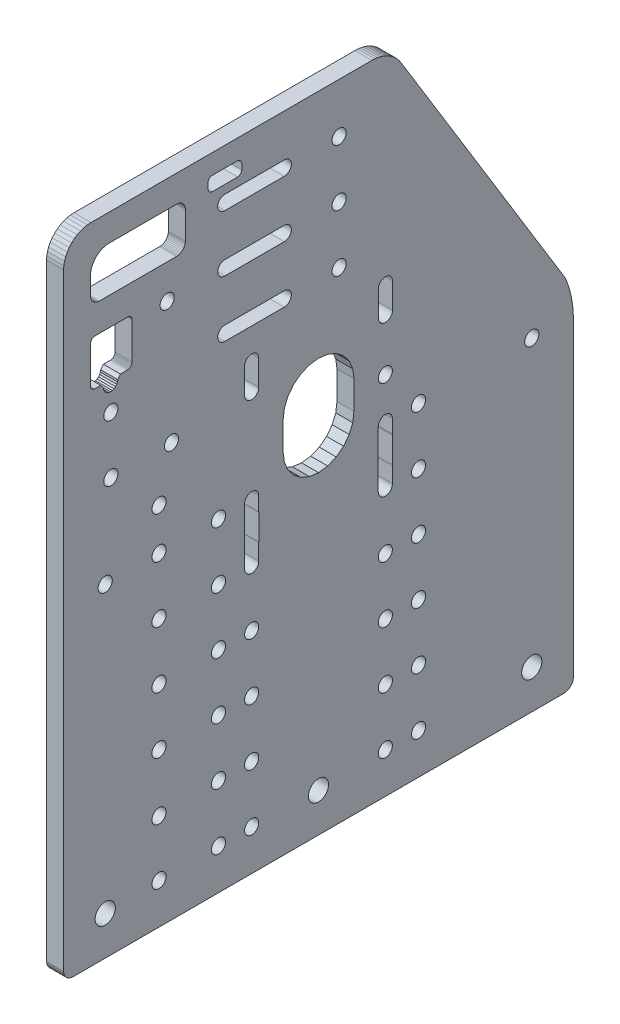
from build123d import *

# Parameters (mm, degrees)
SKETCH1_R           = 3.5685
SKETCH1_R_2         = 2.500000001
SKETCH1_R_3         = 2.5
BOSS_EXTRUDE1_DEPTH = 6
SKETCH2_R           = 2.500000001
SKETCH2_R_2         = 2.5
CUT_EXTRUDE3_DEPTH  = 1779.046328539


with BuildPart() as part:
    # Sketch1 → Boss-Extrude1 (new body)
    with BuildSketch(Plane(origin=(0, 0, 0), x_dir=(0, -1, 0), z_dir=(-1, 0, 0))):
        Polygon((-590.212112636, -1614.243728334), (-495.230350852, -1672.335619946), (-492.985489602, -1673.198794727), (-490.688058814, -1673.910331453), (-488.34828871, -1674.467061724), (-485.976598042, -1674.866506478), (-483.583547703, -1675.10688703), (-481.179793697, -1675.18713299), (-371.826596113, -1675.18713299), (-371.387664827, -1675.158363913), (-370.956243777, -1675.072548931), (-370.539714696, -1674.931156361), (-370.145204514, -1674.736605469), (-369.779463407, -1674.492225074), (-369.448749309, -1674.202196594), (-369.158720829, -1673.871482496), (-368.914340435, -1673.50574139), (-368.719789543, -1673.111231207), (-368.578396973, -1672.694702127), (-368.49258199, -1672.263281077), (-368.463812914, -1671.82434979), (-368.463812914, -1498.50991619), (-368.49258199, -1498.070984903), (-368.578396973, -1497.639563853), (-368.719789543, -1497.223034773), (-368.914340435, -1496.82852459), (-369.158720829, -1496.462783484), (-369.448749309, -1496.132069386), (-369.779463407, -1495.842040906), (-370.145204514, -1495.597660511), (-370.539714696, -1495.403109619), (-370.956243777, -1495.261717049), (-371.387664827, -1495.175902067), (-371.826596113, -1495.14713299), (-586.288106544, -1495.145619765), (-587.549717355, -1495.228301598), (-588.789742622, -1495.474950056), (-589.98696498, -1495.881344878), (-591.12089944, -1496.440532473), (-592.172143895, -1497.142944902), (-593.122711102, -1497.976563587), (-593.956336446, -1498.927124952), (-594.658756242, -1499.978364486), (-595.217951782, -1501.112295027), (-595.624354993, -1502.309514537), (-595.87101214, -1503.549538076), (-595.953702813, -1504.811148308), (-595.953702813, -1603.994310614), (-595.910202971, -1605.015955139), (-595.780018321, -1606.030204482), (-595.564091204, -1607.029716989), (-595.263984611, -1608.007257681), (-594.881870865, -1608.955750621), (-594.420515902, -1609.868330136), (-593.883259242, -1610.738390509), (-593.273989822, -1611.559633802), (-592.597117845, -1612.326115438), (-591.857542854, -1613.032287234), (-591.060618269, -1613.673037558), align=None)
        with Locations(Location((-382.159118976, -1509.84713299, 0), (0, 0, 90))):
            Circle(SKETCH1_R, mode=Mode.SUBTRACT)
        with Locations(Location((-382.159118976, -1585.16713299, 0), (0, 0, 90))):
            Circle(SKETCH1_R, mode=Mode.SUBTRACT)
        with Locations(Location((-382.159118976, -1660.48713299, 0), (0, 0, 90))):
            Circle(SKETCH1_R, mode=Mode.SUBTRACT)
        with Locations(Location((-538.399280751, -1592.457817223, 0), (0, 0, 90))):
            Circle(SKETCH1_R_2, mode=Mode.SUBTRACT)
        with Locations(Location((-558.44846865, -1592.457817223, 0), (0, 0, 90))):
            Circle(SKETCH1_R_2, mode=Mode.SUBTRACT)
        with Locations(Location((-578.44846865, -1592.457817223, 0), (0, 0, 90))):
            Circle(SKETCH1_R_2, mode=Mode.SUBTRACT)
        with Locations(Location((-534.443559506, -1511.847133017, 0), (0, 0, 90))):
            Circle(SKETCH1_R_2, mode=Mode.SUBTRACT)
        with Locations(Location((-558.402442437, -1531.722977175, 0), (0, 0, 90))):
            Circle(SKETCH1_R_2, mode=Mode.SUBTRACT)
        with Locations(Location((-514.443559639, -1511.847132679, 0), (0, 0, 90))):
            Circle(SKETCH1_R_2, mode=Mode.SUBTRACT)
        with Locations(Location((-514.443559639, -1533.238984755, 0), (0, 0, 90))):
            Circle(SKETCH1_R_2, mode=Mode.SUBTRACT)
        with Locations(Location((-497.496167838, -1528.847132988, 0), (0, 0, 90))):
            Circle(SKETCH1_R_3, mode=Mode.SUBTRACT)
        with Locations(Location((-482.799118976, -1549.84713299, 0), (0, 0, 90))):
            Circle(SKETCH1_R_2, mode=Mode.SUBTRACT)
        with Locations(Location((-482.799118976, -1509.84713299, 0), (0, 0, 90))):
            Circle(SKETCH1_R_2, mode=Mode.SUBTRACT)
        with Locations(Location((-482.799118976, -1620.48713299, 0), (0, 0, 90))):
            Circle(SKETCH1_R_2, mode=Mode.SUBTRACT)
        with Locations(Location((-482.799118977, -1660.487132991, 0), (0, 0, 90))):
            Circle(SKETCH1_R_2, mode=Mode.SUBTRACT)
        with Locations(Location((-402.49616799, -1528.847132989, 0), (0, 0, 90))):
            Circle(SKETCH1_R_2, mode=Mode.SUBTRACT)
        with BuildLine():
            Line((-575.977758464, -1552.084054241), (-575.977758464, -1573.056806032))
            ThreePointArc((-575.977758464, -1573.056806032), (-578.457148005, -1575.577342323), (-580.977684295, -1573.097952782))
            Line((-580.977684295, -1573.097952782), (-580.977684295, -1552.084054231))
            ThreePointArc((-580.977684295, -1552.084054231), (-578.477721375, -1549.570437307), (-575.977758464, -1552.084054241))
        make_face(mode=Mode.SUBTRACT)
        with BuildLine():
            Line((-535.977790671, -1552.085412401), (-535.977790671, -1573.058164192))
            ThreePointArc((-535.977790671, -1573.058164192), (-538.457180211, -1575.578700483), (-540.977716502, -1573.099310942))
            Line((-540.977716502, -1573.099310942), (-540.977716502, -1552.085412391))
            ThreePointArc((-540.977716502, -1552.085412391), (-538.477753581, -1549.571795467), (-535.977790671, -1552.085412401))
        make_face(mode=Mode.SUBTRACT)
        with BuildLine():
            Line((-555.97770846, -1552.099177314), (-555.97770846, -1573.085546029))
            ThreePointArc((-555.97770846, -1573.085546029), (-558.463906443, -1575.599273877), (-560.977634291, -1573.113075895))
            Line((-560.977634291, -1573.113075895), (-560.977634291, -1552.099177304))
            ThreePointArc((-560.977634291, -1552.099177304), (-558.47767137, -1549.58556036), (-555.97770846, -1552.099177314))
        make_face(mode=Mode.SUBTRACT)
        with BuildLine():
            Line((-524.913709892, -1559.055192962), (-515.913733671, -1559.055192962))
            ThreePointArc((-515.913733671, -1559.055192962), (-513.413733671, -1561.555192962), (-515.913733671, -1564.055192962))
            Line((-515.913733671, -1564.055192962), (-524.913709892, -1564.055192962))
            ThreePointArc((-524.913709892, -1564.055192962), (-527.413709892, -1561.555192962), (-524.913709892, -1559.055192962))
        make_face(mode=Mode.SUBTRACT)
        with BuildLine():
            Line((-524.913709892, -1606.299062763), (-515.913733671, -1606.299062763))
            ThreePointArc((-515.913733671, -1606.299062763), (-513.413733671, -1608.799062763), (-515.913733671, -1611.299062763))
            Line((-515.913733671, -1611.299062763), (-524.913709892, -1611.299062763))
            ThreePointArc((-524.913709892, -1611.299062763), (-527.413709892, -1608.799062763), (-524.913709892, -1606.299062763))
        make_face(mode=Mode.SUBTRACT)
        with BuildLine():
            Line((-477.66984009, -1606.299062763), (-468.669863869, -1606.299062763))
            ThreePointArc((-468.669863869, -1606.299062763), (-466.169863869, -1608.799062763), (-468.669863869, -1611.299062763))
            Line((-468.669863869, -1611.299062763), (-477.66984009, -1611.299062763))
            ThreePointArc((-477.66984009, -1611.299062763), (-480.16984009, -1608.799062763), (-477.66984009, -1606.299062763))
        make_face(mode=Mode.SUBTRACT)
        with BuildLine():
            Line((-477.669839463, -1559.052819647), (-468.669863869, -1559.055192962))
            ThreePointArc((-468.669863869, -1559.055192962), (-466.159015015, -1561.567366398), (-468.671188452, -1564.078215252))
            Line((-468.671188452, -1564.078215252), (-477.669845536, -1564.075842286))
            ThreePointArc((-477.669845536, -1564.075842286), (-480.18069465, -1561.564327931), (-477.669839463, -1559.052819647))
        make_face(mode=Mode.SUBTRACT)
        Polygon((-586.033555203, -1536.579108211), (-586.214987166, -1536.211200586), (-586.346845371, -1535.822758839), (-586.426873689, -1535.420429315), (-586.453702813, -1535.011095984), (-586.453702813, -1511.296236305), (-586.396818705, -1510.428352529), (-586.227139684, -1509.575318486), (-585.947569005, -1508.751729823), (-585.5628902, -1507.971678372), (-585.079685229, -1507.248511028), (-584.506221865, -1506.594601387), (-583.852312223, -1506.021138022), (-583.12914488, -1505.537933052), (-582.349093428, -1505.153254247), (-581.525504766, -1504.873683568), (-580.672470722, -1504.704004546), (-579.804586946, -1504.647120438), (-573.616888973, -1504.647120438), (-573.207555642, -1504.673949562), (-572.805226118, -1504.75397788), (-572.416784371, -1504.885836086), (-572.048876746, -1505.067268048), (-571.707798245, -1505.295169417), (-571.399384815, -1505.565640735), (-571.128913497, -1505.874054164), (-570.901012129, -1506.215132665), (-570.719580166, -1506.58304029), (-570.587721961, -1506.971482038), (-570.507693643, -1507.373811562), (-570.480864519, -1507.783144892), (-570.480864519, -1535.011095984), (-570.507693643, -1535.420429315), (-570.587721961, -1535.822758839), (-570.719580166, -1536.211200586), (-570.901012129, -1536.579108211), (-571.128913497, -1536.920186712), (-571.399384815, -1537.228600142), (-571.707798245, -1537.49907146), (-572.048876746, -1537.726972829), (-572.416784371, -1537.908404791), (-572.805226118, -1538.040262996), (-573.207555642, -1538.120291315), (-573.616888973, -1538.147120438), (-583.317678359, -1538.147120438), (-583.72701169, -1538.120291315), (-584.129341214, -1538.040262996), (-584.517782961, -1537.908404791), (-584.885690586, -1537.726972828), (-585.226769087, -1537.49907146), (-585.535182516, -1537.228600142), (-585.805653835, -1536.920186712), align=None, mode=Mode.SUBTRACT)
        Polygon((-560.539732338, -1505.878268758), (-560.469558584, -1505.671543545), (-560.373002121, -1505.475746407), (-560.251715057, -1505.294227488), (-560.107772647, -1505.130092628), (-559.943637786, -1504.986150218), (-559.762118868, -1504.864863154), (-559.56632173, -1504.768306692), (-559.359596516, -1504.698132938), (-559.131202133, -1504.647120439), (-558.927636825, -1504.641264366), (-548.4808636, -1504.645157132), (-545.881846575, -1504.645157132), (-545.667730411, -1504.687747485), (-545.461005198, -1504.757921239), (-545.26520806, -1504.854477702), (-545.083689141, -1504.975764766), (-544.919554281, -1505.119707176), (-544.775611871, -1505.283842037), (-544.654324807, -1505.465360956), (-544.557768345, -1505.661158094), (-544.487594591, -1505.867883307), (-544.445004238, -1506.081999471), (-544.441434684, -1508.267709423), (-543.221041992, -1509.237688263), (-542.573960137, -1509.322613597), (-541.970907354, -1509.572122279), (-541.452980696, -1509.969210703), (-541.055476008, -1510.486817951), (-540.805482577, -1511.089669943), (-540.720037042, -1511.736683313), (-540.804962376, -1512.383765169), (-541.054471058, -1512.986817951), (-541.451559482, -1513.504744609), (-541.96916673, -1513.902249297), (-542.572018722, -1514.152242729), (-543.219032092, -1514.237688263), (-544.432285676, -1515.207667102), (-544.430726027, -1517.677645941), (-544.487594599, -1518.109605632), (-544.557768353, -1518.316330846), (-544.654324816, -1518.512127983), (-544.77561188, -1518.693646902), (-544.91955429, -1518.857781763), (-545.083689151, -1519.001724172), (-545.26520807, -1519.123011236), (-545.461005208, -1519.219567699), (-545.667730421, -1519.289741453), (-546.099691027, -1519.348570172), (-558.957839921, -1519.342717258), (-559.145480362, -1519.342717258), (-559.359596526, -1519.300126905), (-559.566321739, -1519.229953151), (-559.762118877, -1519.133396688), (-559.943637796, -1519.012109624), (-560.107772656, -1518.868167214), (-560.251715066, -1518.704032353), (-560.37300213, -1518.522513435), (-560.469558592, -1518.326716297), (-560.539732347, -1518.119991083), (-560.582322699, -1517.905874919), (-560.582322699, -1517.679609247), (-560.568044472, -1506.083962777), align=None, mode=Mode.SUBTRACT)
        Polygon((-512.609294248, -1578.937135138), (-510.622811466, -1576.348300373), (-508.033976701, -1574.36181759), (-505.019214764, -1573.113062308), (-501.7839767, -1572.687135137), (-491.783976402, -1572.687135137), (-488.548738338, -1573.113062308), (-485.533976401, -1574.36181759), (-482.945141636, -1576.348300373), (-480.958658854, -1578.937135138), (-479.709903572, -1581.951897074), (-479.283976401, -1585.187135138), (-479.709903572, -1588.422373202), (-480.958658854, -1591.437135139), (-482.945141636, -1594.025969904), (-485.533976401, -1596.012452687), (-488.548738338, -1597.261207968), (-491.783976402, -1597.68713514), (-501.7839767, -1597.68713514), (-505.019214764, -1597.261207968), (-508.033976701, -1596.012452687), (-510.622811466, -1594.025969904), (-512.609294248, -1591.437135139), (-513.85804953, -1588.422373202), (-514.283976701, -1585.187135138), (-513.85804953, -1581.951897074), align=None, mode=Mode.SUBTRACT)
        with BuildLine():
            Line((-588.98086362, -1556.648178727), (-588.98086362, -1547.550419842))
            ThreePointArc((-588.98086362, -1547.550419842), (-588.50376059, -1546.590680791), (-587.544021697, -1546.113577446))
            Line((-587.544021697, -1546.113577446), (-585.643575513, -1546.099299227))
            ThreePointArc((-585.643575513, -1546.099299227), (-584.463439705, -1546.588127429), (-583.974611428, -1547.768263206))
            Line((-583.974611428, -1547.768263206), (-583.988889647, -1556.648178564))
            ThreePointArc((-583.988889647, -1556.648178564), (-584.465992569, -1557.607917612), (-585.425731394, -1558.085020984))
            Line((-585.425731394, -1558.085020984), (-587.544021696, -1558.085020984))
            ThreePointArc((-587.544021696, -1558.085020984), (-588.506313615, -1557.610470755), (-588.98086362, -1556.648178727))
        make_face(mode=Mode.SUBTRACT)
    extrude(amount=-BOSS_EXTRUDE1_DEPTH)

    # Sketch2 → Cut-Extrude3 (cut, through all)
    with BuildSketch(Plane(origin=(6, 0, 0), x_dir=(0, 0, -1), z_dir=(1, 0, 0))):
        with BuildLine():
            Line((1606.267132989, 482.799118976), (1606.267132989, 462.799118976))
            ThreePointArc((1606.267132989, 462.799118976), (1608.76713299, 460.299118975), (1611.267132991, 462.799118976))
            Line((1611.267132991, 462.799118976), (1611.267132991, 482.799118976))
            ThreePointArc((1611.267132991, 482.799118976), (1608.76713299, 485.299118977), (1606.267132989, 482.799118976))
        make_face()
        with Locations((1549.84713299, 442.799118976)):
            Circle(SKETCH2_R)
        with Locations(Location((1549.84713299, 482.799118976, 0), (0, 0, 180))):
            Circle(SKETCH2_R)
        with Locations((1549.84713299, 462.799118976)):
            Circle(SKETCH2_R)
        with Locations((1549.84713299, 422.799118976)):
            Circle(SKETCH2_R)
        with Locations((1549.84713299, 402.799118976)):
            Circle(SKETCH2_R)
        with Locations((1549.84713299, 382.799118976)):
            Circle(SKETCH2_R)
        with Locations((1561.56713299, 382.799118976)):
            Circle(SKETCH2_R)
        with Locations((1561.56713299, 402.799118976)):
            Circle(SKETCH2_R)
        with Locations((1561.56713299, 422.799118976)):
            Circle(SKETCH2_R)
        with Locations((1561.56713299, 442.799118976)):
            Circle(SKETCH2_R)
        with BuildLine():
            Line((1564.067132991, 482.799118976), (1564.067132991, 462.799118976))
            ThreePointArc((1564.067132991, 462.799118976), (1561.56713299, 460.299118975), (1559.067132989, 462.799118976))
            Line((1559.067132989, 462.799118976), (1559.067132989, 482.799118976))
            ThreePointArc((1559.067132989, 482.799118976), (1561.56713299, 485.299118977), (1564.067132991, 482.799118976))
        make_face()
        with Locations((1620.48713299, 462.799118976)):
            Circle(SKETCH2_R)
        with Locations((1608.76713299, 402.799118976)):
            Circle(SKETCH2_R)
        with Locations((1608.76713299, 382.799118976)):
            Circle(SKETCH2_R)
        with Locations((1620.48713299, 382.799118976)):
            Circle(SKETCH2_R)
        with Locations((1620.48713299, 402.799118976)):
            Circle(SKETCH2_R)
        with Locations((1620.48713299, 422.799118976)):
            Circle(SKETCH2_R)
        with Locations((1608.76713299, 422.799118976)):
            Circle(SKETCH2_R)
        with Locations((1608.76713299, 442.799118976)):
            Circle(SKETCH2_R)
        with Locations((1620.48713299, 442.799118976)):
            Circle(SKETCH2_R)
        with Locations(Location((1620.48713299, 482.799118976, 0), (0, 0, 180))):
            Circle(SKETCH2_R)
        with Locations((1608.767132988, 497.496167838)):
            Circle(SKETCH2_R_2)
        with Locations((1528.847132988, 382.745908718)):
            Circle(SKETCH2_R_2)
        with Locations((1528.847132988, 462.786116014)):
            Circle(SKETCH2_R_2)
        with Locations((1528.847132988, 442.77606419)):
            Circle(SKETCH2_R_2)
        with Locations((1528.847132988, 482.796167838)):
            Circle(SKETCH2_R_2)
        with Locations((1528.847132988, 422.766012366)):
            Circle(SKETCH2_R_2)
    extrude(amount=-CUT_EXTRUDE3_DEPTH, mode=Mode.SUBTRACT)


solid = part.part
